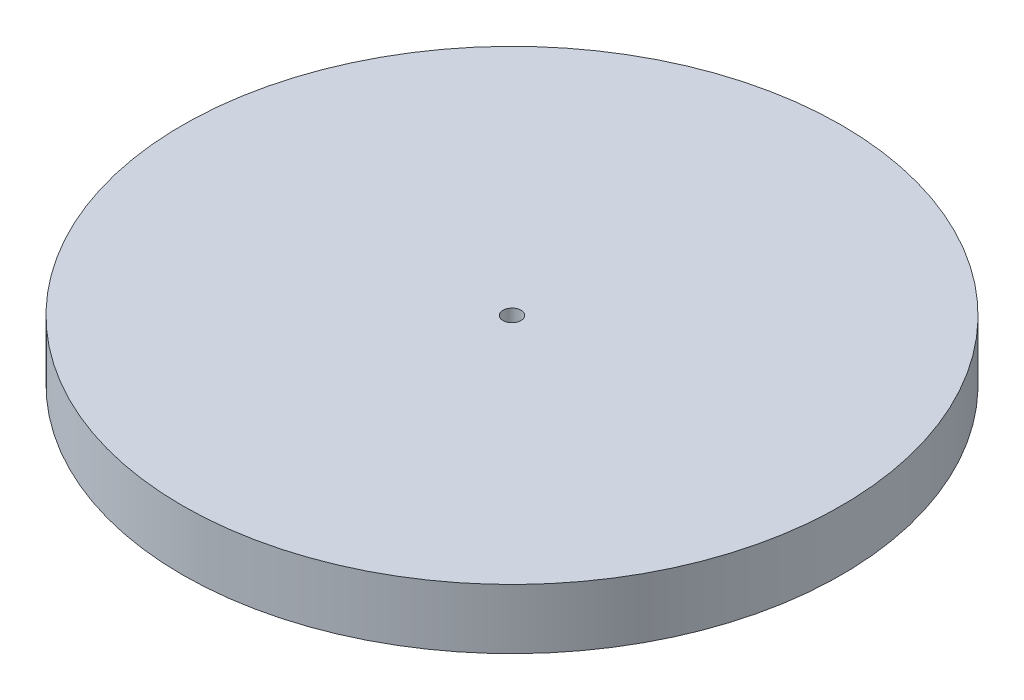
from build123d import *

# Parameters (mm, degrees)
SKETCH2_R           = 12
BOSS_EXTRUDE1_DEPTH = 5
SKETCH3_R           = 0.75
CUT_EXTRUDE1_DEPTH  = 5
SKETCH4_R           = 27.5
BOSS_EXTRUDE2_DEPTH = 5
SKETCH5_R           = 0.75
CUT_EXTRUDE2_DEPTH  = 15


with BuildPart() as part:
    # Sketch2 → Boss-Extrude1 (new body)
    with BuildSketch(Plane(origin=(0, 0, 0), x_dir=(1, 0, 0), z_dir=(0, 1, 0))):
        with Locations(Location((0, 0, 0), (0, 0, 270))):
            Circle(SKETCH2_R)
    extrude(amount=BOSS_EXTRUDE1_DEPTH)

    # Sketch3 → Cut-Extrude1 (cut)
    with BuildSketch(Plane(origin=(0, 5, 0), x_dir=(1, 0, 0), z_dir=(0, 1, 0))):
        with Locations(Location((0, 0, 0), (0, 0, 270))):
            Circle(SKETCH3_R)
    extrude(amount=-CUT_EXTRUDE1_DEPTH, mode=Mode.SUBTRACT)

    # Sketch4 → Boss-Extrude2 (add)
    with BuildSketch(Plane(origin=(0, 5, 0), x_dir=(1, 0, 0), z_dir=(0, 1, 0))):
        with Locations(Location((0, 0, 0), (0, 0, 270))):
            Circle(SKETCH4_R)
    extrude(amount=BOSS_EXTRUDE2_DEPTH)

    # Sketch5 → Cut-Extrude2 (cut)
    with BuildSketch(Plane(origin=(0, 10, 0), x_dir=(1, 0, 0), z_dir=(0, 1, 0))):
        with Locations(Location((0, 0, 0), (0, 0, 270))):
            Circle(SKETCH5_R)
    extrude(amount=-CUT_EXTRUDE2_DEPTH, mode=Mode.SUBTRACT)


solid = part.part
